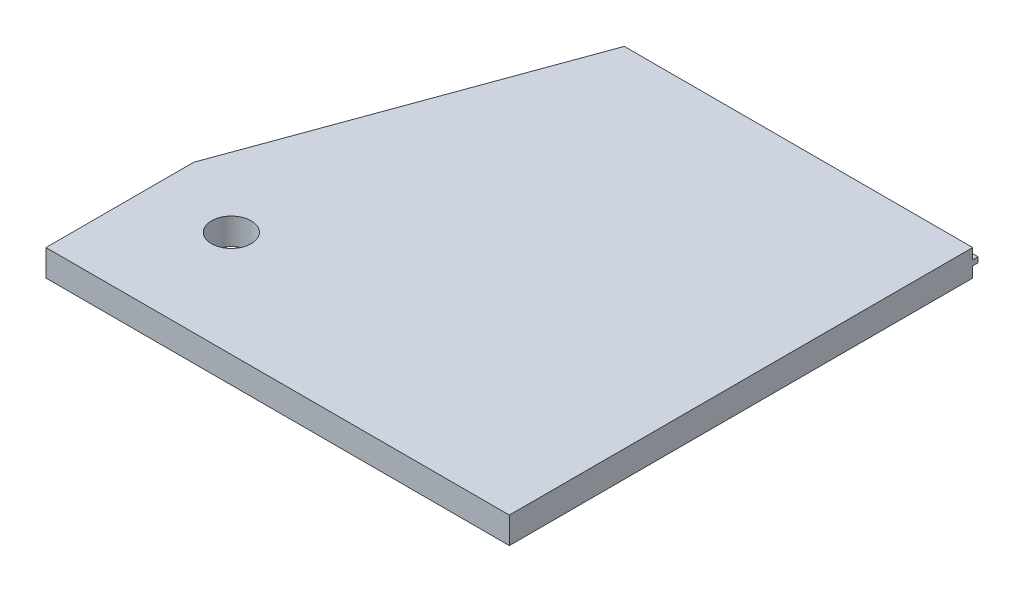
from build123d import *

# Parameters (mm, degrees)
BOSS_EXTRUDE1_DEPTH = 10
SKETCH2_W           = 131.59
SKETCH2_H           = 2
BOSS_EXTRUDE2_DEPTH = 2
SKETCH3_R           = 7.5
CUT_EXTRUDE1_DEPTH  = 250.106402969


with BuildPart() as part:
    # Sketch1 → Boss-Extrude1 (new body)
    with BuildSketch(Plane(origin=(0, 0, 0), x_dir=(1, 0, 0), z_dir=(0, 1, 0))):
        Polygon((0, 55.76), (43.41, 175), (175, 175), (175, 0), (0, 0), align=None)
    extrude(amount=BOSS_EXTRUDE1_DEPTH)

    # Sketch2 → Boss-Extrude2 (add)
    with BuildSketch(Plane(origin=(0, 0, -175), x_dir=(-1, 0, 0), z_dir=(0, 0, -1))):
        with Locations((-109.205, 5)):
            Rectangle(SKETCH2_W, SKETCH2_H)
    extrude(amount=BOSS_EXTRUDE2_DEPTH)

    # Sketch3 → Cut-Extrude1 (cut, through all)
    with BuildSketch(Plane(origin=(0, 10, 0), x_dir=(1, 0, 0), z_dir=(0, 1, 0))):
        with Locations(Location((30, 40, 0), (0, 0, 270))):
            Circle(SKETCH3_R)
    extrude(amount=-CUT_EXTRUDE1_DEPTH, mode=Mode.SUBTRACT)


solid = part.part
